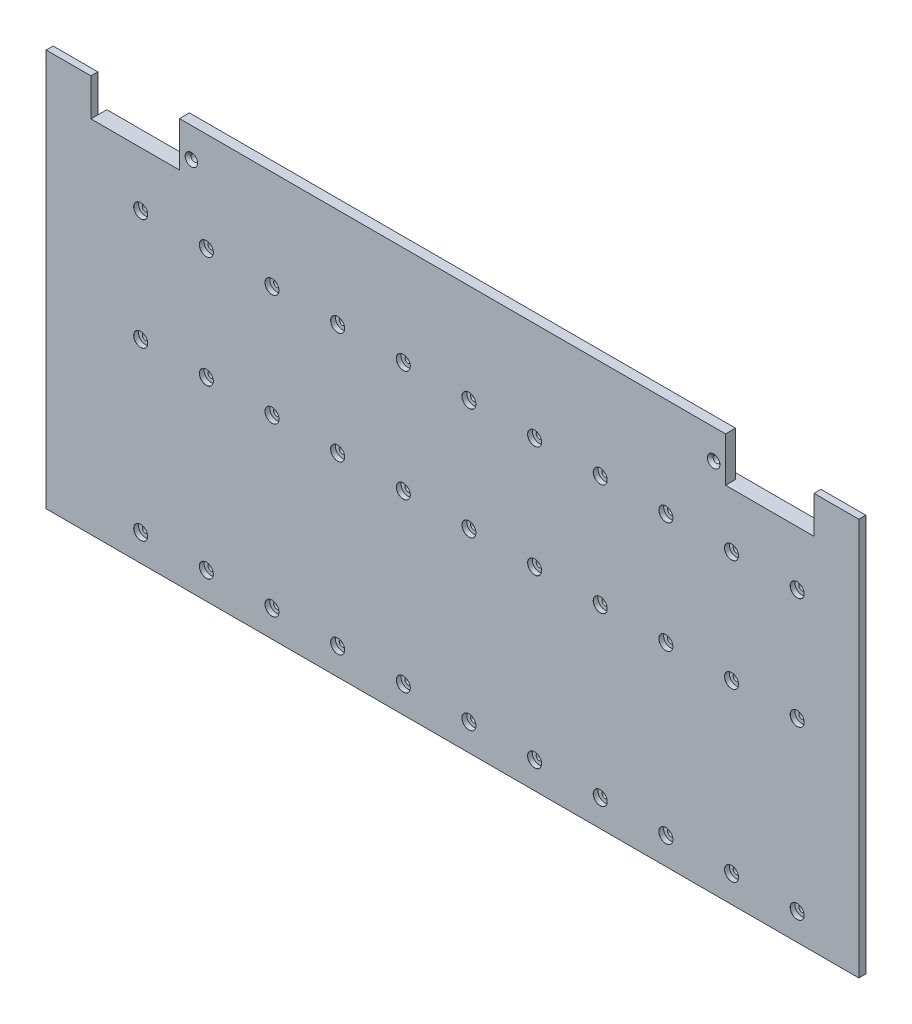
from build123d import *

# Parameters (mm, degrees)
ESQUISSE1_W                                    = 408.5
ESQUISSE1_H                                    = 181
BOSS_EXTRU_1_DEPTH                             = 8
CHAMBRAGE_POUR_VIS_T_TE_RONDE_BOMB_2_COUNT     = 2
CHAMBRAGE_POUR_VIS_T_TE_RONDE_BOMB_2_PITCH     = 56
CHAMBRAGE_POUR_VIS_T_TE_RONDE_BOMB_3_COUNT     = 2
CHAMBRAGE_POUR_VIS_T_TE_RONDE_BOMB_3_PITCH     = 140
R_P_TITION_LIN_AIRE1_COUNT                     = 11
R_P_TITION_LIN_AIRE1_PITCH                     = 33
ESQUISSE4_W                                    = 22.5
ESQUISSE4_H                                    = 4.5
ENL_V_MAT_EXTRU_1_DEPTH                        = 181
ESQUISSE5_W                                    = 22.5
ESQUISSE5_H                                    = 18.725
BOSS_EXTRU_2_DEPTH                             = 3.5
ESQUISSE7_W                                    = 274.5
ESQUISSE7_H                                    = 22.375
BOSS_EXTRU_3_DEPTH                             = 5
FRAISAGE_POUR_VIS_T_TE_FRAIS_E_M31_D           = 3.4
FRAISAGE_POUR_VIS_T_TE_FRAIS_E_M31_CSINK_D     = 6.3
FRAISAGE_POUR_VIS_T_TE_FRAIS_E_M31_CSINK_ANGLE = 90


with BuildPart() as part:
    # Esquisse1 → Boss.-Extru.1 (new body)
    with BuildSketch(Plane.XY):
        Rectangle(ESQUISSE1_W, ESQUISSE1_H)
    extrude(amount=BOSS_EXTRU_1_DEPTH)

    # Esquisse3 → Chambrage pour vis à tête ronde bombée M31 (revolve, cut)
    with BuildSketch(Plane(origin=(-156.75, 63, 8), x_dir=(0, -1, 0), z_dir=(1, 0, 0))):
        Polygon((0, 0), (0, 8), (1.6, 8), (1.6, 2.4), (3.5, 2.4), (3.5, 0.025), (3.525, 0), align=None)
    chambrage_pour_vis_t_te_ronde_bomb_e_m = revolve(axis=Axis((-156.75, 63, 14.35), (0, 0, -1)), mode=Mode.SUBTRACT)

    # Chambrage pour vis _ t_te ronde bomb 2: Chambrage pour vis à tête ronde bombée M31 ×2
    with Locations(*[(0, -i * CHAMBRAGE_POUR_VIS_T_TE_RONDE_BOMB_2_PITCH, 0) for i in range(1, CHAMBRAGE_POUR_VIS_T_TE_RONDE_BOMB_2_COUNT)]):
        add(chambrage_pour_vis_t_te_ronde_bomb_e_m, mode=Mode.SUBTRACT)

    # Chambrage pour vis _ t_te ronde bomb 3: Chambrage pour vis à tête ronde bombée M31 ×2
    with Locations(*[(0, -i * CHAMBRAGE_POUR_VIS_T_TE_RONDE_BOMB_3_PITCH, 0) for i in range(1, CHAMBRAGE_POUR_VIS_T_TE_RONDE_BOMB_3_COUNT)]):
        add(chambrage_pour_vis_t_te_ronde_bomb_e_m, mode=Mode.SUBTRACT)

    # Répétition linéaire1: Chambrage pour vis à tête ronde bombée M31 ×11
    with Locations(*[(i * R_P_TITION_LIN_AIRE1_PITCH, 0, 0) for i in range(1, R_P_TITION_LIN_AIRE1_COUNT)]):
        add(chambrage_pour_vis_t_te_ronde_bomb_e_m, mode=Mode.SUBTRACT)

    # Répétition linéaire1 copy 1 sketch → Répétition linéaire1 copy 1 (revolve, cut)
    with BuildSketch(Plane(origin=(-123.75, 7, 8), x_dir=(0, -1, 0), z_dir=(1, 0, 0))):
        Polygon((0, 0), (0, 8), (1.6, 8), (1.6, 2.4), (3.5, 2.4), (3.5, 0.025), (3.525, 0), align=None)
    revolve(axis=Axis((-123.75, 7, 14.35), (0, 0, -1)), mode=Mode.SUBTRACT)

    # Répétition linéaire1 copy 2 sketch → Répétition linéaire1 copy 2 (revolve, cut)
    with BuildSketch(Plane(origin=(-90.75, 7, 8), x_dir=(0, -1, 0), z_dir=(1, 0, 0))):
        Polygon((0, 0), (0, 8), (1.6, 8), (1.6, 2.4), (3.5, 2.4), (3.5, 0.025), (3.525, 0), align=None)
    revolve(axis=Axis((-90.75, 7, 14.35), (0, 0, -1)), mode=Mode.SUBTRACT)

    # Répétition linéaire1 copy 3 sketch → Répétition linéaire1 copy 3 (revolve, cut)
    with BuildSketch(Plane(origin=(-57.75, 7, 8), x_dir=(0, -1, 0), z_dir=(1, 0, 0))):
        Polygon((0, 0), (0, 8), (1.6, 8), (1.6, 2.4), (3.5, 2.4), (3.5, 0.025), (3.525, 0), align=None)
    revolve(axis=Axis((-57.75, 7, 14.35), (0, 0, -1)), mode=Mode.SUBTRACT)

    # Répétition linéaire1 copy 4 sketch → Répétition linéaire1 copy 4 (revolve, cut)
    with BuildSketch(Plane(origin=(-24.75, 7, 8), x_dir=(0, -1, 0), z_dir=(1, 0, 0))):
        Polygon((0, 0), (0, 8), (1.6, 8), (1.6, 2.4), (3.5, 2.4), (3.5, 0.025), (3.525, 0), align=None)
    revolve(axis=Axis((-24.75, 7, 14.35), (0, 0, -1)), mode=Mode.SUBTRACT)

    # Répétition linéaire1 copy 5 sketch → Répétition linéaire1 copy 5 (revolve, cut)
    with BuildSketch(Plane(origin=(8.25, 7, 8), x_dir=(0, -1, 0), z_dir=(1, 0, 0))):
        Polygon((0, 0), (0, 8), (1.6, 8), (1.6, 2.4), (3.5, 2.4), (3.5, 0.025), (3.525, 0), align=None)
    revolve(axis=Axis((8.25, 7, 14.35), (0, 0, -1)), mode=Mode.SUBTRACT)

    # Répétition linéaire1 copy 6 sketch → Répétition linéaire1 copy 6 (revolve, cut)
    with BuildSketch(Plane(origin=(41.25, 7, 8), x_dir=(0, -1, 0), z_dir=(1, 0, 0))):
        Polygon((0, 0), (0, 8), (1.6, 8), (1.6, 2.4), (3.5, 2.4), (3.5, 0.025), (3.525, 0), align=None)
    revolve(axis=Axis((41.25, 7, 14.35), (0, 0, -1)), mode=Mode.SUBTRACT)

    # Répétition linéaire1 copy 7 sketch → Répétition linéaire1 copy 7 (revolve, cut)
    with BuildSketch(Plane(origin=(74.25, 7, 8), x_dir=(0, -1, 0), z_dir=(1, 0, 0))):
        Polygon((0, 0), (0, 8), (1.6, 8), (1.6, 2.4), (3.5, 2.4), (3.5, 0.025), (3.525, 0), align=None)
    revolve(axis=Axis((74.25, 7, 14.35), (0, 0, -1)), mode=Mode.SUBTRACT)

    # Répétition linéaire1 copy 8 sketch → Répétition linéaire1 copy 8 (revolve, cut)
    with BuildSketch(Plane(origin=(107.25, 7, 8), x_dir=(0, -1, 0), z_dir=(1, 0, 0))):
        Polygon((0, 0), (0, 8), (1.6, 8), (1.6, 2.4), (3.5, 2.4), (3.5, 0.025), (3.525, 0), align=None)
    revolve(axis=Axis((107.25, 7, 14.35), (0, 0, -1)), mode=Mode.SUBTRACT)

    # Répétition linéaire1 copy 9 sketch → Répétition linéaire1 copy 9 (revolve, cut)
    with BuildSketch(Plane(origin=(140.25, 7, 8), x_dir=(0, -1, 0), z_dir=(1, 0, 0))):
        Polygon((0, 0), (0, 8), (1.6, 8), (1.6, 2.4), (3.5, 2.4), (3.5, 0.025), (3.525, 0), align=None)
    revolve(axis=Axis((140.25, 7, 14.35), (0, 0, -1)), mode=Mode.SUBTRACT)

    # Répétition linéaire1 copy 10 sketch → Répétition linéaire1 copy 10 (revolve, cut)
    with BuildSketch(Plane(origin=(173.25, 7, 8), x_dir=(0, -1, 0), z_dir=(1, 0, 0))):
        Polygon((0, 0), (0, 8), (1.6, 8), (1.6, 2.4), (3.5, 2.4), (3.5, 0.025), (3.525, 0), align=None)
    revolve(axis=Axis((173.25, 7, 14.35), (0, 0, -1)), mode=Mode.SUBTRACT)

    # Répétition linéaire1 copy 11 sketch → Répétition linéaire1 copy 11 (revolve, cut)
    with BuildSketch(Plane(origin=(-123.75, -77, 8), x_dir=(0, -1, 0), z_dir=(1, 0, 0))):
        Polygon((0, 0), (0, 8), (1.6, 8), (1.6, 2.4), (3.5, 2.4), (3.5, 0.025), (3.525, 0), align=None)
    revolve(axis=Axis((-123.75, -77, 14.35), (0, 0, -1)), mode=Mode.SUBTRACT)

    # Répétition linéaire1 copy 12 sketch → Répétition linéaire1 copy 12 (revolve, cut)
    with BuildSketch(Plane(origin=(-90.75, -77, 8), x_dir=(0, -1, 0), z_dir=(1, 0, 0))):
        Polygon((0, 0), (0, 8), (1.6, 8), (1.6, 2.4), (3.5, 2.4), (3.5, 0.025), (3.525, 0), align=None)
    revolve(axis=Axis((-90.75, -77, 14.35), (0, 0, -1)), mode=Mode.SUBTRACT)

    # Répétition linéaire1 copy 13 sketch → Répétition linéaire1 copy 13 (revolve, cut)
    with BuildSketch(Plane(origin=(-57.75, -77, 8), x_dir=(0, -1, 0), z_dir=(1, 0, 0))):
        Polygon((0, 0), (0, 8), (1.6, 8), (1.6, 2.4), (3.5, 2.4), (3.5, 0.025), (3.525, 0), align=None)
    revolve(axis=Axis((-57.75, -77, 14.35), (0, 0, -1)), mode=Mode.SUBTRACT)

    # Répétition linéaire1 copy 14 sketch → Répétition linéaire1 copy 14 (revolve, cut)
    with BuildSketch(Plane(origin=(-24.75, -77, 8), x_dir=(0, -1, 0), z_dir=(1, 0, 0))):
        Polygon((0, 0), (0, 8), (1.6, 8), (1.6, 2.4), (3.5, 2.4), (3.5, 0.025), (3.525, 0), align=None)
    revolve(axis=Axis((-24.75, -77, 14.35), (0, 0, -1)), mode=Mode.SUBTRACT)

    # Répétition linéaire1 copy 15 sketch → Répétition linéaire1 copy 15 (revolve, cut)
    with BuildSketch(Plane(origin=(8.25, -77, 8), x_dir=(0, -1, 0), z_dir=(1, 0, 0))):
        Polygon((0, 0), (0, 8), (1.6, 8), (1.6, 2.4), (3.5, 2.4), (3.5, 0.025), (3.525, 0), align=None)
    revolve(axis=Axis((8.25, -77, 14.35), (0, 0, -1)), mode=Mode.SUBTRACT)

    # Répétition linéaire1 copy 16 sketch → Répétition linéaire1 copy 16 (revolve, cut)
    with BuildSketch(Plane(origin=(41.25, -77, 8), x_dir=(0, -1, 0), z_dir=(1, 0, 0))):
        Polygon((0, 0), (0, 8), (1.6, 8), (1.6, 2.4), (3.5, 2.4), (3.5, 0.025), (3.525, 0), align=None)
    revolve(axis=Axis((41.25, -77, 14.35), (0, 0, -1)), mode=Mode.SUBTRACT)

    # Répétition linéaire1 copy 17 sketch → Répétition linéaire1 copy 17 (revolve, cut)
    with BuildSketch(Plane(origin=(74.25, -77, 8), x_dir=(0, -1, 0), z_dir=(1, 0, 0))):
        Polygon((0, 0), (0, 8), (1.6, 8), (1.6, 2.4), (3.5, 2.4), (3.5, 0.025), (3.525, 0), align=None)
    revolve(axis=Axis((74.25, -77, 14.35), (0, 0, -1)), mode=Mode.SUBTRACT)

    # Répétition linéaire1 copy 18 sketch → Répétition linéaire1 copy 18 (revolve, cut)
    with BuildSketch(Plane(origin=(107.25, -77, 8), x_dir=(0, -1, 0), z_dir=(1, 0, 0))):
        Polygon((0, 0), (0, 8), (1.6, 8), (1.6, 2.4), (3.5, 2.4), (3.5, 0.025), (3.525, 0), align=None)
    revolve(axis=Axis((107.25, -77, 14.35), (0, 0, -1)), mode=Mode.SUBTRACT)

    # Répétition linéaire1 copy 19 sketch → Répétition linéaire1 copy 19 (revolve, cut)
    with BuildSketch(Plane(origin=(140.25, -77, 8), x_dir=(0, -1, 0), z_dir=(1, 0, 0))):
        Polygon((0, 0), (0, 8), (1.6, 8), (1.6, 2.4), (3.5, 2.4), (3.5, 0.025), (3.525, 0), align=None)
    revolve(axis=Axis((140.25, -77, 14.35), (0, 0, -1)), mode=Mode.SUBTRACT)

    # Répétition linéaire1 copy 20 sketch → Répétition linéaire1 copy 20 (revolve, cut)
    with BuildSketch(Plane(origin=(173.25, -77, 8), x_dir=(0, -1, 0), z_dir=(1, 0, 0))):
        Polygon((0, 0), (0, 8), (1.6, 8), (1.6, 2.4), (3.5, 2.4), (3.5, 0.025), (3.525, 0), align=None)
    revolve(axis=Axis((173.25, -77, 14.35), (0, 0, -1)), mode=Mode.SUBTRACT)

    # Esquisse4 → Enlèv. mat.-Extru.1 (cut)
    with BuildSketch(Plane(origin=(0, 90.5, 0), x_dir=(1, 0, 0), z_dir=(0, 1, 0))):
        with Locations((-193, -2.25)):
            Rectangle(ESQUISSE4_W, ESQUISSE4_H)
        with Locations((193, -2.25)):
            Rectangle(ESQUISSE4_W, ESQUISSE4_H)
    extrude(amount=-ENL_V_MAT_EXTRU_1_DEPTH, mode=Mode.SUBTRACT)

    # Esquisse5 → Boss.-Extru.2 (add)
    with BuildSketch(Plane.XY.offset(8)):
        with Locations((-193, 99.8625)):
            Rectangle(ESQUISSE5_W, ESQUISSE5_H)
    boss_extru_2 = extrude(amount=-BOSS_EXTRU_2_DEPTH)

    # Symétrie1: Boss.-Extru.2 across plane
    add(boss_extru_2.mirror(Plane(origin=(0, 0, 0), x_dir=(0, 0, 1), z_dir=(1, 0, 0))))

    # Esquisse7 → Boss.-Extru.3 (add)
    with BuildSketch(Plane.XY.offset(8)):
        with Locations((0, 101.6875)):
            Rectangle(ESQUISSE7_W, ESQUISSE7_H)
    extrude(amount=-BOSS_EXTRU_3_DEPTH)

    # Fraisage pour vis à tête fraisée M31 (through all)
    with Locations(Plane.XY.offset(8)):
        with Locations((-131.25, 98), (131.25, 98)):
            CounterSinkHole(FRAISAGE_POUR_VIS_T_TE_FRAIS_E_M31_D / 2, FRAISAGE_POUR_VIS_T_TE_FRAIS_E_M31_CSINK_D / 2, counter_sink_angle=FRAISAGE_POUR_VIS_T_TE_FRAIS_E_M31_CSINK_ANGLE)


solid = part.part
